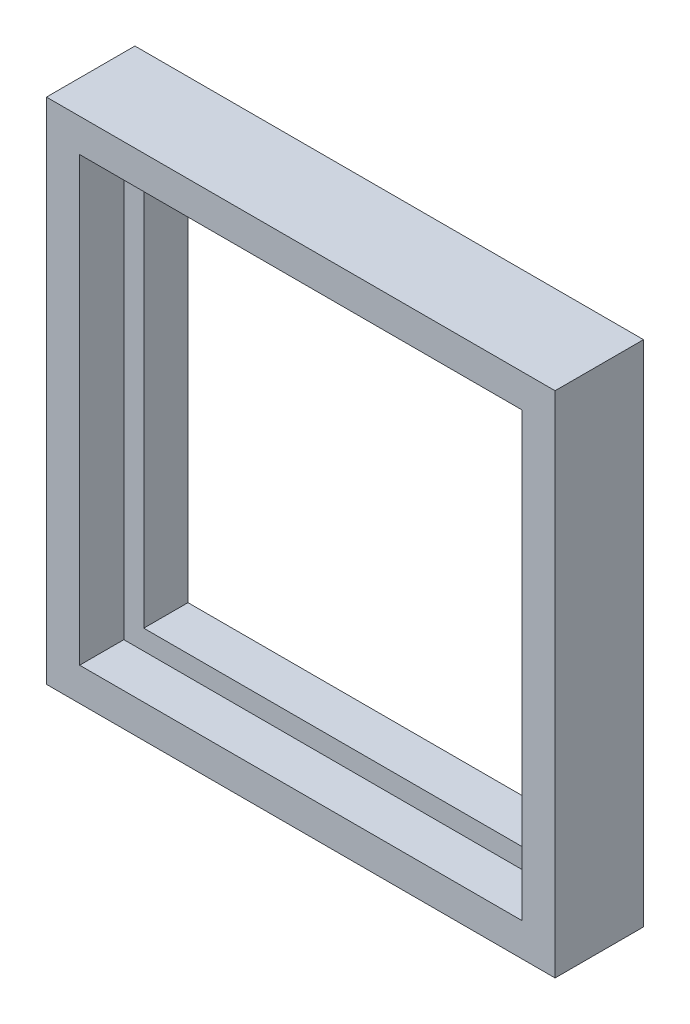
from build123d import *

# Parameters (mm, degrees)
SKETCH_1_W      = 11.5
SKETCH_1_H      = 11.5
SKETCH_1_W_2    = 10
SKETCH_1_H_2    = 10
EXTRUDE_1_DEPTH = 1
SKETCH_2_W      = 11.5
SKETCH_2_H      = 11.5
SKETCH_2_W_2    = 9.1
SKETCH_2_H_2    = 9.1
EXTRUDE_2_DEPTH = 1


with BuildPart() as part:
    # 草图1 → 凸台-拉伸1 (new body)
    with BuildSketch(Plane.XY):
        Rectangle(SKETCH_1_W, SKETCH_1_H)
        Rectangle(SKETCH_1_W_2, SKETCH_1_H_2, mode=Mode.SUBTRACT)
    extrude(amount=EXTRUDE_1_DEPTH)

    # 草图2 → 凸台-拉伸2 (add)
    with BuildSketch(Plane(origin=(0, 0, 0), x_dir=(-1, 0, 0), z_dir=(0, 0, -1))):
        Rectangle(SKETCH_2_W, SKETCH_2_H)
        Rectangle(SKETCH_2_W_2, SKETCH_2_H_2, mode=Mode.SUBTRACT)
    extrude(amount=EXTRUDE_2_DEPTH)


solid = part.part
